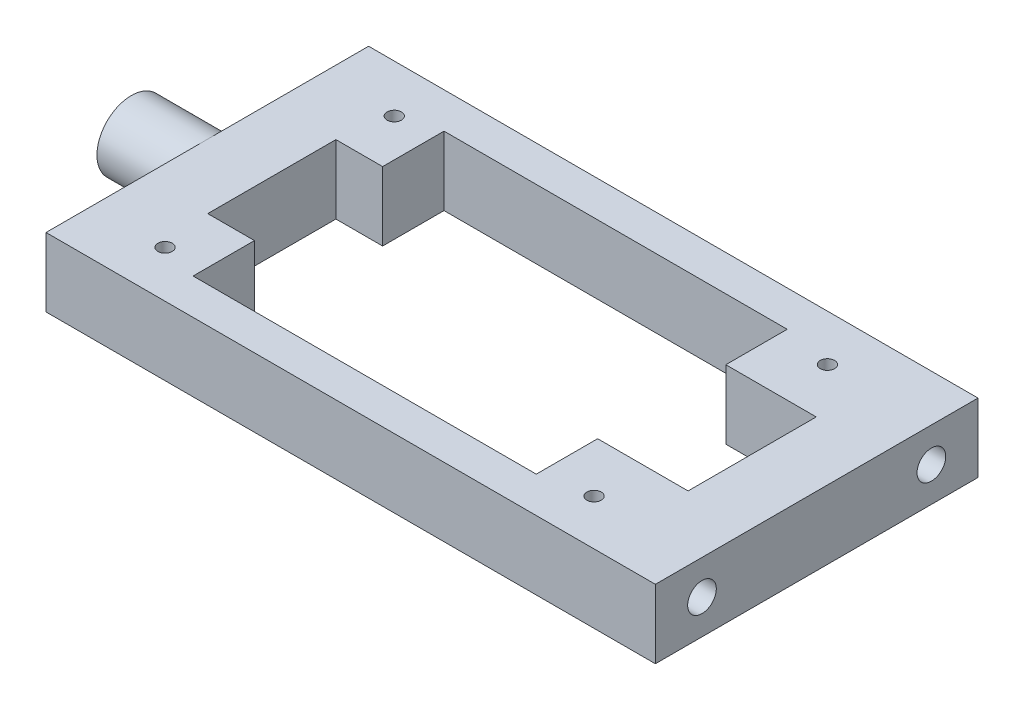
from build123d import *

# Parameters (mm, degrees)
SKETCH8_R               = 35
BOSS_EXTRUDE3_DEPTH     = 1
BOSS_EXTRUDE4_START     = -53.594889
SKETCH9_R               = 5
BOSS_EXTRUDE4_DEPTH     = 113.594889
CUT_EXTRUDE2_START      = -20.791267
SKETCH10_R              = 4
CUT_EXTRUDE2_DEPTH      = 20.791267
SKETCH11_R              = 1.5
CUT_EXTRUDE3_DEPTH      = 73.971936727
BOSS_EXTRUDE5_REACH     = 74.567
SKETCH13_W              = 88.883012554
SKETCH13_H              = 5.53578549
CUT_EXTRUDE4_DEPTH      = 110.338922716
SKETCH14_R              = 1
CUT_EXTRUDE5_DEPTH      = 71.019198384
SKETCH15_W              = 75.166178786
SKETCH15_H              = 0.46421451
SKETCH15_W_2            = 75.463979311
CUT_EXTRUDE6_DEPTH      = 109.72955086
CUT_EXTRUDE7_DEPTH      = 109.707210391
CUT_EXTRUDE7_DEPTH_BACK = 109.707210391
SKETCH16_W              = 74.883691919
SKETCH16_H              = 0.2
SKETCH17_W              = 45
SKETCH17_H              = 9.670623623
CUT_EXTRUDE8_DEPTH      = 25
SKETCH18_W              = 45.166247069
SKETCH18_H              = 9.6
BOSS_EXTRUDE6_DEPTH     = 7
SKETCH19_R              = 2
CUT_EXTRUDE9_DEPTH      = 8.2
SKETCH20_W              = 85
SKETCH20_H              = 13.048799846
SKETCH20_W_2            = 85.000162577
SKETCH20_H_2            = 13.925318183
CUT_EXTRUDE10_DEPTH     = 9.6
CUT_EXTRUDE11_DEPTH     = 59.913683698
SKETCH22_R              = 5
SKETCH22_R_2            = 4.8
CUT_EXTRUDE12_DEPTH     = 10.594889107


with BuildPart() as part:
    # Sketch1 → Revolve1 (revolve)
    with BuildSketch(Plane.XY):
        with BuildLine():
            Line((-32.912878475, 10), (-22.912878475, 10))
            ThreePointArc((-22.912878475, 10), (-25, 0), (-22.912878475, -10))
            Line((-22.912878475, -10), (-32.912878475, -10))
            ThreePointArc((-32.912878475, -10), (-34.398511152, 0), (-32.912878475, 10))
        make_face()
    revolve(axis=Axis((0, 0, 0), (0, 1, 0)))

    # Sketch8 → Boss-Extrude3 (add)
    with BuildSketch(Plane.XZ.offset(10)):
        with Locations(Location((0, 0, 0), (0, 0, 270))):
            Circle(SKETCH8_R)
    extrude(amount=BOSS_EXTRUDE3_DEPTH)

    # Sketch9 → Boss-Extrude4 (add)
    with BuildSketch(Plane(origin=(0, 0, 0), x_dir=(0, 0, -1), z_dir=(1, 0, 0)).offset(BOSS_EXTRUDE4_START)):
        Circle(SKETCH9_R)
    extrude(amount=BOSS_EXTRUDE4_DEPTH)

    # Sketch10 → Cut-Extrude2 (cut)
    with BuildSketch(Plane(origin=(60, 0, 0), x_dir=(0, 0, -1), z_dir=(1, 0, 0)).offset(CUT_EXTRUDE2_START)):
        Circle(SKETCH10_R)
    extrude(amount=CUT_EXTRUDE2_DEPTH, mode=Mode.SUBTRACT)

    # Sketch11 → Cut-Extrude3 (cut, through all)
    with BuildSketch(Plane(origin=(0, 0.188776478, -4.996435073), x_dir=(-1, 0, 0), z_dir=(0, 0.03775529554410709, -0.9992870146551377))):
        with Locations(Location((-55, 0, 0), (0, 0, 90))):
            Circle(SKETCH11_R)
    extrude(amount=-CUT_EXTRUDE3_DEPTH, mode=Mode.SUBTRACT)

    # Boss-Extrude5: up to this face of the body (flat: up to its plane)
    boss_extrude5_end = Plane(part.part.faces().sort_by_distance((31.981961692, 10, 0))[0])
    # Sketch12 → Boss-Extrude5 (add, up to the picked face)
    with BuildSketch(Plane.XZ.offset(11), mode=Mode.PRIVATE) as boss_extrude5_sk1:
        Polygon((-43, -22.5), (-43, 22.5), (-16.841508162, 22.5), (-16.841508162, 28.986561578), (16.841508162, 28.986561578), (16.841508162, 22.5), (35, 22.5), (35, -22.5), (16.384759584, -22.5), (16.384759584, -28.901286862), (-16.384759584, -28.901286862), (-16.384759584, -22.5), align=None)
    boss_extrude5_tool1 = split(extrude(boss_extrude5_sk1.sketch, amount=-BOSS_EXTRUDE5_REACH, mode=Mode.PRIVATE), bisect_by=boss_extrude5_end, keep=Keep.BOTH, mode=Mode.PRIVATE)
    add(boss_extrude5_tool1.solids().sort_by(Axis((-3.565032, -11, 0.05927), (0, 1, 0)))[0])

    # Sketch13 → Cut-Extrude4 (cut, through all)
    with BuildSketch(Plane.ZY.offset(43)):
        with Locations((0, -8.232107255)):
            Rectangle(SKETCH13_W, SKETCH13_H)
        with Locations((0, 8.232107255)):
            Rectangle(SKETCH13_W, SKETCH13_H)
    extrude(amount=-CUT_EXTRUDE4_DEPTH, mode=Mode.SUBTRACT)

    # Sketch14 → Cut-Extrude5 (cut, through all)
    with BuildSketch(Plane.XZ.offset(5.46421451)):
        with Locations(Location((-32.903541804, 15.993560443, 0), (0, 0, 270))):
            Circle(SKETCH14_R)
        with Locations(Location((-32.779476251, -15.854024353, 0), (0, 0, 270))):
            Circle(SKETCH14_R)
        with Locations(Location((27.068192394, 16.122002754, 0), (0, 0, 270))):
            Circle(SKETCH14_R)
        with Locations(Location((27.449995703, -16.044926007, 0), (0, 0, 270))):
            Circle(SKETCH14_R)
    extrude(amount=-CUT_EXTRUDE5_DEPTH, mode=Mode.SUBTRACT)

    # Sketch15 → Cut-Extrude6 (cut, through all)
    with BuildSketch(Plane.ZY.offset(43)):
        with Locations((-0.380582347, 5.232107255)):
            Rectangle(SKETCH15_W, SKETCH15_H)
        with Locations((0.06827951, -5.232107255)):
            Rectangle(SKETCH15_W_2, SKETCH15_H)
    extrude(amount=-CUT_EXTRUDE6_DEPTH, mode=Mode.SUBTRACT)

    # Sketch16 → Cut-Extrude7 (cut, two sides: drawn at the far end of the back side and taken through both)
    with BuildSketch(Plane.ZY.offset(43).offset(-CUT_EXTRUDE7_DEPTH_BACK)):
        with Locations((-0.578270867, 4.9)):
            Rectangle(SKETCH16_W, SKETCH16_H)
        with Locations((-0.578270867, -4.9)):
            Rectangle(SKETCH16_W, SKETCH16_H)
    extrude(amount=CUT_EXTRUDE7_DEPTH + CUT_EXTRUDE7_DEPTH_BACK, mode=Mode.SUBTRACT)

    # Sketch17 → Cut-Extrude8 (cut)
    with BuildSketch(Plane(origin=(35, 0, 0), x_dir=(0, 0, -1), z_dir=(1, 0, 0))):
        with Locations((0, 0.035311811)):
            Rectangle(SKETCH17_W, SKETCH17_H)
    extrude(amount=CUT_EXTRUDE8_DEPTH, mode=Mode.SUBTRACT)

    # Sketch18 → Boss-Extrude6 (add)
    with BuildSketch(Plane(origin=(35, 0, 0), x_dir=(0, 0, -1), z_dir=(1, 0, 0))):
        with Locations((-0.083123535, 0)):
            Rectangle(SKETCH18_W, SKETCH18_H)
    extrude(amount=BOSS_EXTRUDE6_DEPTH)

    # Sketch19 → Cut-Extrude9 (cut)
    with BuildSketch(Plane(origin=(42, 0, 0), x_dir=(0, 0, -1), z_dir=(1, 0, 0))):
        with Locations((-16, 0.011242039)):
            Circle(SKETCH19_R)
        with Locations((16, 0.011242039)):
            Circle(SKETCH19_R)
    extrude(amount=-CUT_EXTRUDE9_DEPTH, mode=Mode.SUBTRACT)

    # Sketch20 → Cut-Extrude10 (cut)
    with BuildSketch(Plane(origin=(0, 4.8, 0), x_dir=(1, 0, 0), z_dir=(0, 1, 0))):
        with Locations((-0.5, 29.024399923)):
            Rectangle(SKETCH20_W, SKETCH20_H)
        with Locations((-0.499918711, -29.462659092)):
            Rectangle(SKETCH20_W_2, SKETCH20_H_2)
    extrude(amount=-CUT_EXTRUDE10_DEPTH, mode=Mode.SUBTRACT)

    # Sketch21 → Cut-Extrude11 (cut, through all)
    with BuildSketch(Plane.XZ.offset(4.8)):
        Polygon((-34, -8.937993072), (-34, 8.937993072), (-27.4832705, 8.937993072), (-27.4832705, 17.5), (20.384920046, 17.5), (20.384920046, 8.937993072), (33, 8.937993072), (33, -8.937993072), (20.384920046, -8.937993072), (20.384920046, -17.5), (-27.4832705, -17.5), (-27.4832705, -8.937993072), align=None)
    extrude(amount=-CUT_EXTRUDE11_DEPTH, mode=Mode.SUBTRACT)

    # Sketch22 → Cut-Extrude12 (cut)
    with BuildSketch(Plane.ZY.offset(53.594889107)):
        Circle(SKETCH22_R)
        with Locations(Location((0, 0, 0), (0, 0, 270))):
            Circle(SKETCH22_R_2, mode=Mode.SUBTRACT)
    extrude(amount=-CUT_EXTRUDE12_DEPTH, mode=Mode.SUBTRACT)


solid = part.part
